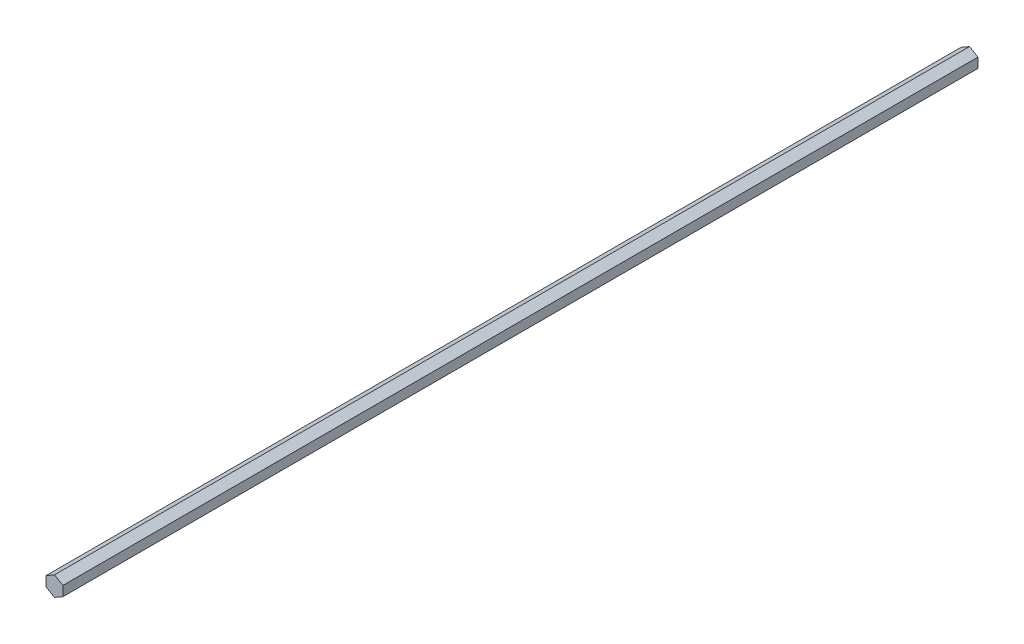
from build123d import *

# Parameters (mm, degrees)
BOSS_EXTRUDE1_DEPTH = 342.9


with BuildPart() as part:
    # Sketch1 → Boss-Extrude1 (new, symmetric)
    with BuildSketch(Plane.XY):
        Polygon((6.35, 3.666174209), (0, 7.332348419), (-6.35, 3.666174209), (-6.35, -3.666174209), (0, -7.332348419), (6.35, -3.666174209), align=None)
    extrude(amount=BOSS_EXTRUDE1_DEPTH, both=True)


solid = part.part
